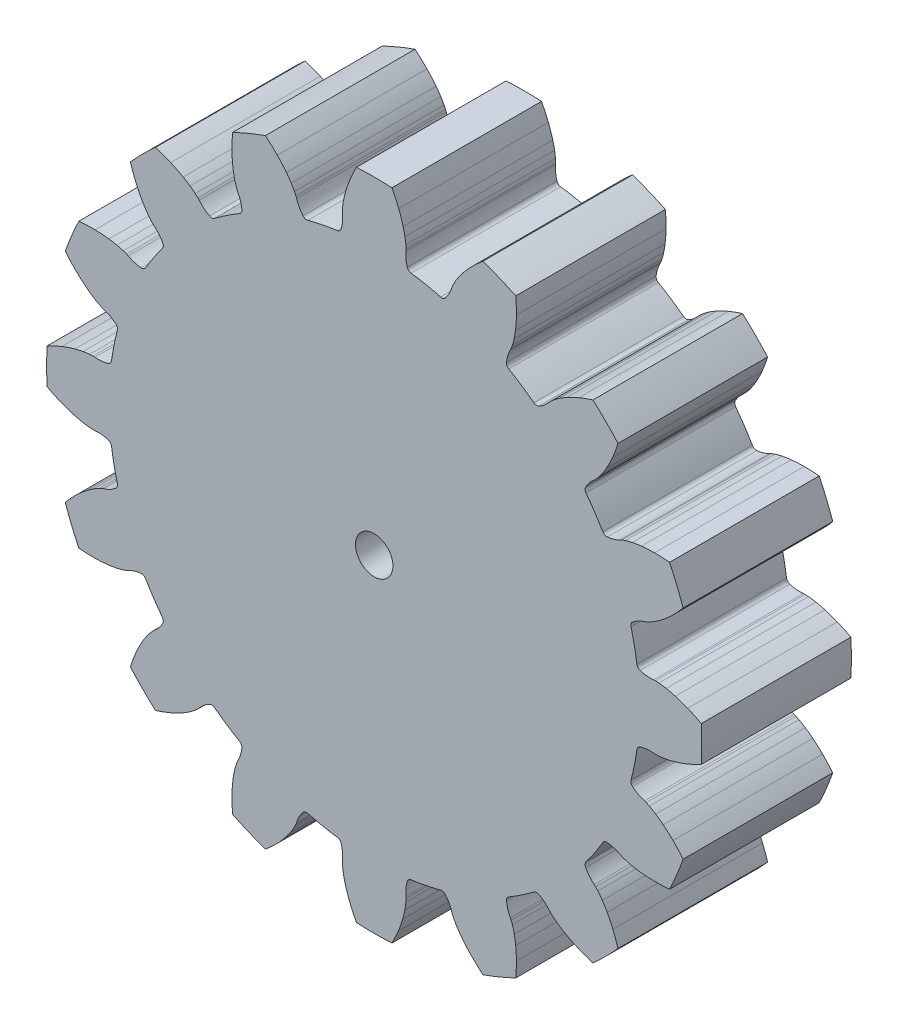
from build123d import *

# Parameters (mm, degrees)
BOSS_EXTRUDE1_DEPTH = 12.7
SKETCH2_R           = 1.5875
CUT_EXTRUDE1_DEPTH  = 42.321307839


with BuildPart() as part:
    # Model → Boss-Extrude1 (new body)
    with BuildSketch(Plane.XY):
        with BuildLine():
            ThreePointArc((22.086724936, -4.393322745), (22.202755532, -3.763289774), (22.300817937, -3.130211256))
            ThreePointArc((22.300817937, -3.130211256), (22.391700215, -2.928061147), (22.576827182, -2.806191293))
            ThreePointArc((22.576827182, -2.806191293), (23.141348869, -2.692426056), (23.717218917, -2.693402016))
            ThreePointArc((23.717218917, -2.693402016), (23.795990351, -2.699103522), (23.874961367, -2.700115778))
            ThreePointArc((23.874961367, -2.700115778), (24.020610065, -2.695308298), (24.166028598, -2.685815903))
            ThreePointArc((24.166028598, -2.685815903), (24.443766141, -2.656087394), (24.719639861, -2.612319628))
            ThreePointArc((24.719639861, -2.612319628), (25.058590913, -2.542497556), (25.39440211, -2.458868748))
            ThreePointArc((25.39440211, -2.458868748), (25.960652326, -2.287370407), (26.515782007, -2.08271942))
            ThreePointArc((26.515782007, -2.08271942), (27.147013649, -1.809737889), (27.763557433, -1.505031367))
            ThreePointArc((27.763557433, -1.505031367), (27.804320541, 0), (27.763557433, 1.505031367))
            ThreePointArc((27.763557433, 1.505031367), (27.192336158, 1.788710415), (26.608421948, 2.045248409))
            ThreePointArc((26.608421948, 2.045248409), (26.087795145, 2.243333519), (25.557268985, 2.413133319))
            ThreePointArc((25.557268985, 2.413133319), (25.175253154, 2.514973473), (24.789072057, 2.599659205))
            ThreePointArc((24.789072057, 2.599659205), (24.478759923, 2.6514833), (24.166028997, 2.68581587))
            ThreePointArc((24.166028997, 2.68581587), (24.020610388, 2.695308282), (23.874961613, 2.700115775))
            ThreePointArc((23.874961613, 2.700115775), (23.79599049, 2.699103524), (23.71721895, 2.693402019))
            ThreePointArc((23.71721895, 2.693402019), (23.141348906, 2.692426051), (22.576827219, 2.806191272))
            ThreePointArc((22.576827219, 2.806191272), (22.391700244, 2.928061115), (22.300817942, 3.130211215))
            ThreePointArc((22.300817942, 3.130211215), (22.08672494, 4.393322725), (21.801149238, 5.64221544))
            ThreePointArc((21.801149238, 5.64221544), (21.807754017, 5.863756931), (21.932151458, 6.047195017))
            ThreePointArc((21.932151458, 6.047195017), (22.410165419, 6.368333489), (22.942573453, 6.587807746))
            ThreePointArc((22.942573453, 6.587807746), (23.017530641, 6.612684764), (23.09087772, 6.641970461))
            ThreePointArc((23.09087772, 6.641970461), (23.223599828, 6.702149337), (23.354316452, 6.76656843))
            ThreePointArc((23.354316452, 6.76656843), (23.599535876, 6.900319547), (23.83766076, 7.046327993))
            ThreePointArc((23.83766076, 7.046327993), (24.12409095, 7.240546128), (24.402336682, 7.446318452))
            ThreePointArc((24.402336682, 7.446318452), (24.859854093, 7.821456836), (25.294410501, 8.222968626))
            ThreePointArc((25.294410501, 8.222968626), (25.773126986, 8.716732567), (26.226133031, 9.234185777))
            ThreePointArc((26.226133031, 9.234185777), (25.687842663, 10.640252819), (25.074231893, 12.015121129))
            ThreePointArc((25.074231893, 12.015121129), (24.437932976, 12.058609477), (23.800293749, 12.072165385))
            ThreePointArc((23.800293749, 12.072165385), (23.243493412, 12.055936912), (22.688371581, 12.0097879))
            ThreePointArc((22.688371581, 12.0097879), (22.296462434, 11.957684804), (21.907269796, 11.888139111))
            ThreePointArc((21.907269796, 11.888139111), (21.600746544, 11.817267019), (21.298682337, 11.729309234))
            ThreePointArc((21.298682337, 11.729309234), (21.160700471, 11.682429787), (21.024298801, 11.631133957))
            ThreePointArc((21.024298801, 11.631133957), (20.951726369, 11.599977819), (20.881132826, 11.564565752))
            ThreePointArc((20.881132826, 11.564565752), (20.349471766, 11.34328815), (19.784385669, 11.232360413))
            ThreePointArc((19.784385669, 11.232360413), (19.566713076, 11.27410844), (19.405389283, 11.426091629))
            ThreePointArc((19.405389283, 11.426091629), (18.724221293, 12.511124655), (17.982453195, 13.555665983))
            ThreePointArc((17.982453195, 13.555665983), (17.903774957, 13.762871171), (17.948504491, 13.979950705))
            ThreePointArc((17.948504491, 13.979950705), (18.267237433, 14.459571989), (18.675129157, 14.866083497))
            ThreePointArc((18.675129157, 14.866083497), (18.734860545, 14.917751739), (18.791417259, 14.972876907))
            ThreePointArc((18.791417259, 14.972876907), (18.89100704, 15.079265491), (18.987121334, 15.188804058))
            ThreePointArc((18.987121334, 15.188804058), (19.162490204, 15.406215388), (19.326613898, 15.632236051))
            ThreePointArc((19.326613898, 15.632236051), (19.516916824, 15.921282299), (19.695236702, 16.21787117))
            ThreePointArc((19.695236702, 16.21787117), (19.97436843, 16.739538178), (20.222194291, 17.27678424))
            ThreePointArc((20.222194291, 17.27678424), (20.475515373, 17.916159507), (20.696017616, 18.567581845))
            ThreePointArc((20.696017616, 18.567581845), (19.660623601, 19.660623601), (18.567581845, 20.696017616))
            ThreePointArc((18.567581845, 20.696017616), (17.96307603, 20.492694557), (17.368786577, 20.261204615))
            ThreePointArc((17.368786577, 20.261204615), (16.860580509, 20.033133198), (16.365375275, 19.778061142))
            ThreePointArc((16.365375275, 19.778061142), (16.023237426, 19.57994702), (15.690284298, 19.366757603))
            ThreePointArc((15.690284298, 19.366757603), (15.434215315, 19.183978958), (15.188804364, 18.987121593))
            ThreePointArc((15.188804364, 18.987121593), (15.07926573, 18.891007257), (14.972877082, 18.791417431))
            ThreePointArc((14.972877082, 18.791417431), (14.917751836, 18.734860646), (14.866083518, 18.675129183))
            ThreePointArc((14.866083518, 18.675129183), (14.459572019, 18.267237456), (13.979950747, 17.948504502))
            ThreePointArc((13.979950747, 17.948504502), (13.762871214, 17.903774955), (13.555666016, 17.98245317))
            ThreePointArc((13.555666016, 17.98245317), (12.511124689, 18.72422127), (11.426091665, 19.405389262))
            ThreePointArc((11.426091665, 19.405389262), (11.274108459, 19.566713037), (11.232360418, 19.784385626))
            ThreePointArc((11.232360418, 19.784385626), (11.34328814, 20.34947173), (11.564565736, 20.881132797))
            ThreePointArc((11.564565736, 20.881132797), (11.599977764, 20.951726241), (11.631133866, 21.024298573))
            ThreePointArc((11.631133866, 21.024298573), (11.682429677, 21.160700167), (11.729309111, 21.298681955))
            ThreePointArc((11.729309111, 21.298681955), (11.808129107, 21.566654594), (11.873265265, 21.838277877))
            ThreePointArc((11.873265265, 21.838277877), (11.938469034, 22.178147567), (11.989715472, 22.520400017))
            ThreePointArc((11.989715472, 22.520400017), (12.047966241, 23.109176576), (12.071332314, 23.700366068))
            ThreePointArc((12.071332314, 23.700366068), (12.060692156, 24.388013572), (12.015121129, 25.074231893))
            ThreePointArc((12.015121129, 25.074231893), (10.640252819, 25.687842663), (9.234185777, 26.226133031))
            ThreePointArc((9.234185777, 26.226133031), (8.753503593, 25.806952658), (8.293039097, 25.365659111))
            ThreePointArc((8.293039097, 25.365659111), (7.910797066, 24.960466554), (7.550898935, 24.535303864))
            ThreePointArc((7.550898935, 24.535303864), (7.310619771, 24.221339795), (7.084595249, 23.896962811))
            ThreePointArc((7.084595249, 23.896962811), (6.917964716, 23.630104004), (6.766568613, 23.354316809))
            ThreePointArc((6.766568613, 23.354316809), (6.702149475, 23.223600121), (6.641970558, 23.090877946))
            ThreePointArc((6.641970558, 23.090877946), (6.612684816, 23.017530771), (6.587807755, 22.942573485))
            ThreePointArc((6.587807755, 22.942573485), (6.368333508, 22.410165451), (6.047195052, 21.932151485))
            ThreePointArc((6.047195052, 21.932151485), (5.863756971, 21.807754032), (5.64221548, 21.801149227))
            ThreePointArc((5.64221548, 21.801149227), (4.393322765, 22.086724932), (3.130211256, 22.300817937))
            ThreePointArc((3.130211256, 22.300817937), (2.928061147, 22.391700215), (2.806191293, 22.576827182))
            ThreePointArc((2.806191293, 22.576827182), (2.692426056, 23.141348869), (2.693402016, 23.717218917))
            ThreePointArc((2.693402016, 23.717218917), (2.699103522, 23.795990351), (2.700115778, 23.874961367))
            ThreePointArc((2.700115778, 23.874961367), (2.695308298, 24.020610065), (2.685815903, 24.166028598))
            ThreePointArc((2.685815903, 24.166028598), (2.656087394, 24.443766141), (2.612319628, 24.719639861))
            ThreePointArc((2.612319628, 24.719639861), (2.542497556, 25.058590913), (2.458868748, 25.39440211))
            ThreePointArc((2.458868748, 25.39440211), (2.287370407, 25.960652326), (2.08271942, 26.515782007))
            ThreePointArc((2.08271942, 26.515782007), (1.809737889, 27.147013649), (1.505031367, 27.763557433))
            ThreePointArc((1.505031367, 27.763557433), (0, 27.804320541), (-1.505031367, 27.763557433))
            ThreePointArc((-1.505031367, 27.763557433), (-1.788710415, 27.192336158), (-2.045248409, 26.608421948))
            ThreePointArc((-2.045248409, 26.608421948), (-2.243333519, 26.087795145), (-2.413133319, 25.557268985))
            ThreePointArc((-2.413133319, 25.557268985), (-2.514973473, 25.175253154), (-2.599659205, 24.789072057))
            ThreePointArc((-2.599659205, 24.789072057), (-2.6514833, 24.478759923), (-2.68581587, 24.166028997))
            ThreePointArc((-2.68581587, 24.166028997), (-2.695308282, 24.020610388), (-2.700115775, 23.874961613))
            ThreePointArc((-2.700115775, 23.874961613), (-2.699103524, 23.79599049), (-2.693402019, 23.71721895))
            ThreePointArc((-2.693402019, 23.71721895), (-2.692426051, 23.141348906), (-2.806191272, 22.576827219))
            ThreePointArc((-2.806191272, 22.576827219), (-2.928061115, 22.391700244), (-3.130211215, 22.300817942))
            ThreePointArc((-3.130211215, 22.300817942), (-4.393322725, 22.08672494), (-5.64221544, 21.801149238))
            ThreePointArc((-5.64221544, 21.801149238), (-5.863756931, 21.807754017), (-6.047195017, 21.932151458))
            ThreePointArc((-6.047195017, 21.932151458), (-6.368333489, 22.410165419), (-6.587807746, 22.942573453))
            ThreePointArc((-6.587807746, 22.942573453), (-6.612684764, 23.017530641), (-6.641970461, 23.09087772))
            ThreePointArc((-6.641970461, 23.09087772), (-6.702149337, 23.223599828), (-6.76656843, 23.354316452))
            ThreePointArc((-6.76656843, 23.354316452), (-6.900319547, 23.599535876), (-7.046327993, 23.83766076))
            ThreePointArc((-7.046327993, 23.83766076), (-7.240546128, 24.12409095), (-7.446318452, 24.402336682))
            ThreePointArc((-7.446318452, 24.402336682), (-7.821456836, 24.859854093), (-8.222968626, 25.294410501))
            ThreePointArc((-8.222968626, 25.294410501), (-8.716732567, 25.773126986), (-9.234185777, 26.226133031))
            ThreePointArc((-9.234185777, 26.226133031), (-10.640252819, 25.687842663), (-12.015121129, 25.074231893))
            ThreePointArc((-12.015121129, 25.074231893), (-12.058609477, 24.437932976), (-12.072165385, 23.800293749))
            ThreePointArc((-12.072165385, 23.800293749), (-12.055936912, 23.243493412), (-12.0097879, 22.688371581))
            ThreePointArc((-12.0097879, 22.688371581), (-11.957684804, 22.296462434), (-11.888139111, 21.907269796))
            ThreePointArc((-11.888139111, 21.907269796), (-11.817267019, 21.600746544), (-11.729309234, 21.298682337))
            ThreePointArc((-11.729309234, 21.298682337), (-11.682429787, 21.160700471), (-11.631133957, 21.024298801))
            ThreePointArc((-11.631133957, 21.024298801), (-11.599977819, 20.951726369), (-11.564565752, 20.881132826))
            ThreePointArc((-11.564565752, 20.881132826), (-11.34328815, 20.349471766), (-11.232360413, 19.784385669))
            ThreePointArc((-11.232360413, 19.784385669), (-11.27410844, 19.566713076), (-11.426091629, 19.405389283))
            ThreePointArc((-11.426091629, 19.405389283), (-12.511124655, 18.724221293), (-13.555665983, 17.982453195))
            ThreePointArc((-13.555665983, 17.982453195), (-13.762871171, 17.903774957), (-13.979950705, 17.948504491))
            ThreePointArc((-13.979950705, 17.948504491), (-14.459571989, 18.267237433), (-14.866083497, 18.675129157))
            ThreePointArc((-14.866083497, 18.675129157), (-14.917751739, 18.734860545), (-14.972876907, 18.791417259))
            ThreePointArc((-14.972876907, 18.791417259), (-15.079265491, 18.89100704), (-15.188804058, 18.987121334))
            ThreePointArc((-15.188804058, 18.987121334), (-15.406215388, 19.162490204), (-15.632236051, 19.326613898))
            ThreePointArc((-15.632236051, 19.326613898), (-15.921282299, 19.516916824), (-16.21787117, 19.695236702))
            ThreePointArc((-16.21787117, 19.695236702), (-16.739538178, 19.97436843), (-17.27678424, 20.222194291))
            ThreePointArc((-17.27678424, 20.222194291), (-17.916159507, 20.475515373), (-18.567581845, 20.696017616))
            ThreePointArc((-18.567581845, 20.696017616), (-19.660623601, 19.660623601), (-20.696017616, 18.567581845))
            ThreePointArc((-20.696017616, 18.567581845), (-20.492694557, 17.96307603), (-20.261204615, 17.368786577))
            ThreePointArc((-20.261204615, 17.368786577), (-20.033133198, 16.860580509), (-19.778061142, 16.365375275))
            ThreePointArc((-19.778061142, 16.365375275), (-19.57994702, 16.023237426), (-19.366757603, 15.690284298))
            ThreePointArc((-19.366757603, 15.690284298), (-19.183978958, 15.434215315), (-18.987121593, 15.188804364))
            ThreePointArc((-18.987121593, 15.188804364), (-18.891007257, 15.07926573), (-18.791417431, 14.972877082))
            ThreePointArc((-18.791417431, 14.972877082), (-18.734860646, 14.917751836), (-18.675129183, 14.866083518))
            ThreePointArc((-18.675129183, 14.866083518), (-18.267237456, 14.459572019), (-17.948504502, 13.979950747))
            ThreePointArc((-17.948504502, 13.979950747), (-17.903774955, 13.762871214), (-17.98245317, 13.555666016))
            ThreePointArc((-17.98245317, 13.555666016), (-18.72422127, 12.511124689), (-19.405389262, 11.426091665))
            ThreePointArc((-19.405389262, 11.426091665), (-19.566713037, 11.274108459), (-19.784385626, 11.232360418))
            ThreePointArc((-19.784385626, 11.232360418), (-20.34947173, 11.34328814), (-20.881132797, 11.564565736))
            ThreePointArc((-20.881132797, 11.564565736), (-20.951726241, 11.599977764), (-21.024298573, 11.631133866))
            ThreePointArc((-21.024298573, 11.631133866), (-21.160700167, 11.682429677), (-21.298681955, 11.729309111))
            ThreePointArc((-21.298681955, 11.729309111), (-21.566654594, 11.808129107), (-21.838277877, 11.873265265))
            ThreePointArc((-21.838277877, 11.873265265), (-22.178147567, 11.938469034), (-22.520400017, 11.989715472))
            ThreePointArc((-22.520400017, 11.989715472), (-23.109176576, 12.047966241), (-23.700366068, 12.071332314))
            ThreePointArc((-23.700366068, 12.071332314), (-24.388013572, 12.060692156), (-25.074231893, 12.015121129))
            ThreePointArc((-25.074231893, 12.015121129), (-25.687842663, 10.640252819), (-26.226133031, 9.234185777))
            ThreePointArc((-26.226133031, 9.234185777), (-25.806952658, 8.753503593), (-25.365659111, 8.293039097))
            ThreePointArc((-25.365659111, 8.293039097), (-24.960466554, 7.910797066), (-24.535303864, 7.550898935))
            ThreePointArc((-24.535303864, 7.550898935), (-24.221339795, 7.310619771), (-23.896962811, 7.084595249))
            ThreePointArc((-23.896962811, 7.084595249), (-23.630104004, 6.917964716), (-23.354316809, 6.766568613))
            ThreePointArc((-23.354316809, 6.766568613), (-23.223600121, 6.702149475), (-23.090877946, 6.641970558))
            ThreePointArc((-23.090877946, 6.641970558), (-23.017530771, 6.612684816), (-22.942573485, 6.587807755))
            ThreePointArc((-22.942573485, 6.587807755), (-22.410165451, 6.368333508), (-21.932151485, 6.047195052))
            ThreePointArc((-21.932151485, 6.047195052), (-21.807754032, 5.863756971), (-21.801149227, 5.64221548))
            ThreePointArc((-21.801149227, 5.64221548), (-22.086724932, 4.393322765), (-22.300817937, 3.130211256))
            ThreePointArc((-22.300817937, 3.130211256), (-22.391700215, 2.928061147), (-22.576827182, 2.806191293))
            ThreePointArc((-22.576827182, 2.806191293), (-23.141348869, 2.692426056), (-23.717218917, 2.693402016))
            ThreePointArc((-23.717218917, 2.693402016), (-23.795990351, 2.699103522), (-23.874961367, 2.700115778))
            ThreePointArc((-23.874961367, 2.700115778), (-24.020610065, 2.695308298), (-24.166028598, 2.685815903))
            ThreePointArc((-24.166028598, 2.685815903), (-24.443766141, 2.656087394), (-24.719639861, 2.612319628))
            ThreePointArc((-24.719639861, 2.612319628), (-25.058590913, 2.542497556), (-25.39440211, 2.458868748))
            ThreePointArc((-25.39440211, 2.458868748), (-25.960652326, 2.287370407), (-26.515782007, 2.08271942))
            ThreePointArc((-26.515782007, 2.08271942), (-27.147013649, 1.809737889), (-27.763557433, 1.505031367))
            ThreePointArc((-27.763557433, 1.505031367), (-27.804320541, 0), (-27.763557433, -1.505031367))
            ThreePointArc((-27.763557433, -1.505031367), (-27.192336158, -1.788710415), (-26.608421948, -2.045248409))
            ThreePointArc((-26.608421948, -2.045248409), (-26.087795145, -2.243333519), (-25.557268985, -2.413133319))
            ThreePointArc((-25.557268985, -2.413133319), (-25.175253154, -2.514973473), (-24.789072057, -2.599659205))
            ThreePointArc((-24.789072057, -2.599659205), (-24.478759923, -2.6514833), (-24.166028997, -2.68581587))
            ThreePointArc((-24.166028997, -2.68581587), (-24.020610388, -2.695308282), (-23.874961613, -2.700115775))
            ThreePointArc((-23.874961613, -2.700115775), (-23.79599049, -2.699103524), (-23.71721895, -2.693402019))
            ThreePointArc((-23.71721895, -2.693402019), (-23.141348906, -2.692426051), (-22.576827219, -2.806191272))
            ThreePointArc((-22.576827219, -2.806191272), (-22.391700244, -2.928061115), (-22.300817942, -3.130211215))
            ThreePointArc((-22.300817942, -3.130211215), (-22.08672494, -4.393322725), (-21.801149238, -5.64221544))
            ThreePointArc((-21.801149238, -5.64221544), (-21.807754017, -5.863756931), (-21.932151458, -6.047195017))
            ThreePointArc((-21.932151458, -6.047195017), (-22.410165419, -6.368333489), (-22.942573453, -6.587807746))
            ThreePointArc((-22.942573453, -6.587807746), (-23.017530641, -6.612684764), (-23.09087772, -6.641970461))
            ThreePointArc((-23.09087772, -6.641970461), (-23.223599828, -6.702149337), (-23.354316452, -6.76656843))
            ThreePointArc((-23.354316452, -6.76656843), (-23.599535876, -6.900319547), (-23.83766076, -7.046327993))
            ThreePointArc((-23.83766076, -7.046327993), (-24.12409095, -7.240546128), (-24.402336682, -7.446318452))
            ThreePointArc((-24.402336682, -7.446318452), (-24.859854093, -7.821456836), (-25.294410501, -8.222968626))
            ThreePointArc((-25.294410501, -8.222968626), (-25.773126986, -8.716732567), (-26.226133031, -9.234185777))
            ThreePointArc((-26.226133031, -9.234185777), (-25.687842663, -10.640252819), (-25.074231893, -12.015121129))
            ThreePointArc((-25.074231893, -12.015121129), (-24.437932976, -12.058609477), (-23.800293749, -12.072165385))
            ThreePointArc((-23.800293749, -12.072165385), (-23.243493412, -12.055936912), (-22.688371581, -12.0097879))
            ThreePointArc((-22.688371581, -12.0097879), (-22.296462434, -11.957684804), (-21.907269796, -11.888139111))
            ThreePointArc((-21.907269796, -11.888139111), (-21.600746544, -11.817267019), (-21.298682337, -11.729309234))
            ThreePointArc((-21.298682337, -11.729309234), (-21.160700471, -11.682429787), (-21.024298801, -11.631133957))
            ThreePointArc((-21.024298801, -11.631133957), (-20.951726369, -11.599977819), (-20.881132826, -11.564565752))
            ThreePointArc((-20.881132826, -11.564565752), (-20.349471766, -11.34328815), (-19.784385669, -11.232360413))
            ThreePointArc((-19.784385669, -11.232360413), (-19.566713076, -11.27410844), (-19.405389283, -11.426091629))
            ThreePointArc((-19.405389283, -11.426091629), (-18.724221293, -12.511124655), (-17.982453195, -13.555665983))
            ThreePointArc((-17.982453195, -13.555665983), (-17.903774957, -13.762871171), (-17.948504491, -13.979950705))
            ThreePointArc((-17.948504491, -13.979950705), (-18.267237433, -14.459571989), (-18.675129157, -14.866083497))
            ThreePointArc((-18.675129157, -14.866083497), (-18.734860545, -14.917751739), (-18.791417259, -14.972876907))
            ThreePointArc((-18.791417259, -14.972876907), (-18.89100704, -15.079265491), (-18.987121334, -15.188804058))
            ThreePointArc((-18.987121334, -15.188804058), (-19.162490204, -15.406215388), (-19.326613898, -15.632236051))
            ThreePointArc((-19.326613898, -15.632236051), (-19.516916824, -15.921282299), (-19.695236702, -16.21787117))
            ThreePointArc((-19.695236702, -16.21787117), (-19.97436843, -16.739538178), (-20.222194291, -17.27678424))
            ThreePointArc((-20.222194291, -17.27678424), (-20.475515373, -17.916159507), (-20.696017616, -18.567581845))
            ThreePointArc((-20.696017616, -18.567581845), (-19.660623601, -19.660623601), (-18.567581845, -20.696017616))
            ThreePointArc((-18.567581845, -20.696017616), (-17.96307603, -20.492694557), (-17.368786577, -20.261204615))
            ThreePointArc((-17.368786577, -20.261204615), (-16.860580509, -20.033133198), (-16.365375275, -19.778061142))
            ThreePointArc((-16.365375275, -19.778061142), (-16.023237426, -19.57994702), (-15.690284298, -19.366757603))
            ThreePointArc((-15.690284298, -19.366757603), (-15.434215315, -19.183978958), (-15.188804364, -18.987121593))
            ThreePointArc((-15.188804364, -18.987121593), (-15.07926573, -18.891007257), (-14.972877082, -18.791417431))
            ThreePointArc((-14.972877082, -18.791417431), (-14.917751836, -18.734860646), (-14.866083518, -18.675129183))
            ThreePointArc((-14.866083518, -18.675129183), (-14.459572019, -18.267237456), (-13.979950747, -17.948504502))
            ThreePointArc((-13.979950747, -17.948504502), (-13.762871214, -17.903774955), (-13.555666016, -17.98245317))
            ThreePointArc((-13.555666016, -17.98245317), (-12.511124689, -18.72422127), (-11.426091665, -19.405389262))
            ThreePointArc((-11.426091665, -19.405389262), (-11.274108459, -19.566713037), (-11.232360418, -19.784385626))
            ThreePointArc((-11.232360418, -19.784385626), (-11.34328814, -20.34947173), (-11.564565736, -20.881132797))
            ThreePointArc((-11.564565736, -20.881132797), (-11.599977764, -20.951726241), (-11.631133866, -21.024298573))
            ThreePointArc((-11.631133866, -21.024298573), (-11.682429677, -21.160700167), (-11.729309111, -21.298681955))
            ThreePointArc((-11.729309111, -21.298681955), (-11.808129107, -21.566654594), (-11.873265265, -21.838277877))
            ThreePointArc((-11.873265265, -21.838277877), (-11.938469034, -22.178147567), (-11.989715472, -22.520400017))
            ThreePointArc((-11.989715472, -22.520400017), (-12.047966241, -23.109176576), (-12.071332314, -23.700366068))
            ThreePointArc((-12.071332314, -23.700366068), (-12.060692156, -24.388013572), (-12.015121129, -25.074231893))
            ThreePointArc((-12.015121129, -25.074231893), (-10.640252819, -25.687842663), (-9.234185777, -26.226133031))
            ThreePointArc((-9.234185777, -26.226133031), (-8.753503593, -25.806952658), (-8.293039097, -25.365659111))
            ThreePointArc((-8.293039097, -25.365659111), (-7.910797066, -24.960466554), (-7.550898935, -24.535303864))
            ThreePointArc((-7.550898935, -24.535303864), (-7.310619771, -24.221339795), (-7.084595249, -23.896962811))
            ThreePointArc((-7.084595249, -23.896962811), (-6.917964716, -23.630104004), (-6.766568613, -23.354316809))
            ThreePointArc((-6.766568613, -23.354316809), (-6.702149475, -23.223600121), (-6.641970558, -23.090877946))
            ThreePointArc((-6.641970558, -23.090877946), (-6.612684816, -23.017530771), (-6.587807755, -22.942573485))
            ThreePointArc((-6.587807755, -22.942573485), (-6.368333508, -22.410165451), (-6.047195052, -21.932151485))
            ThreePointArc((-6.047195052, -21.932151485), (-5.863756971, -21.807754032), (-5.64221548, -21.801149227))
            ThreePointArc((-5.64221548, -21.801149227), (-4.393322765, -22.086724932), (-3.130211256, -22.300817937))
            ThreePointArc((-3.130211256, -22.300817937), (-2.928061147, -22.391700215), (-2.806191293, -22.576827182))
            ThreePointArc((-2.806191293, -22.576827182), (-2.692426056, -23.141348869), (-2.693402016, -23.717218917))
            ThreePointArc((-2.693402016, -23.717218917), (-2.699103522, -23.795990351), (-2.700115778, -23.874961367))
            ThreePointArc((-2.700115778, -23.874961367), (-2.695308298, -24.020610065), (-2.685815903, -24.166028598))
            ThreePointArc((-2.685815903, -24.166028598), (-2.656087394, -24.443766141), (-2.612319628, -24.719639861))
            ThreePointArc((-2.612319628, -24.719639861), (-2.542497556, -25.058590913), (-2.458868748, -25.39440211))
            ThreePointArc((-2.458868748, -25.39440211), (-2.287370407, -25.960652326), (-2.08271942, -26.515782007))
            ThreePointArc((-2.08271942, -26.515782007), (-1.809737889, -27.147013649), (-1.505031367, -27.763557433))
            ThreePointArc((-1.505031367, -27.763557433), (0, -27.804320541), (1.505031367, -27.763557433))
            ThreePointArc((1.505031367, -27.763557433), (1.788710415, -27.192336158), (2.045248409, -26.608421948))
            ThreePointArc((2.045248409, -26.608421948), (2.243333519, -26.087795145), (2.413133319, -25.557268985))
            ThreePointArc((2.413133319, -25.557268985), (2.514973473, -25.175253154), (2.599659205, -24.789072057))
            ThreePointArc((2.599659205, -24.789072057), (2.6514833, -24.478759923), (2.68581587, -24.166028997))
            ThreePointArc((2.68581587, -24.166028997), (2.695308282, -24.020610388), (2.700115775, -23.874961613))
            ThreePointArc((2.700115775, -23.874961613), (2.699103524, -23.79599049), (2.693402019, -23.71721895))
            ThreePointArc((2.693402019, -23.71721895), (2.692426051, -23.141348906), (2.806191272, -22.576827219))
            ThreePointArc((2.806191272, -22.576827219), (2.928061115, -22.391700244), (3.130211215, -22.300817942))
            ThreePointArc((3.130211215, -22.300817942), (4.393322725, -22.08672494), (5.64221544, -21.801149238))
            ThreePointArc((5.64221544, -21.801149238), (5.863756931, -21.807754017), (6.047195017, -21.932151458))
            ThreePointArc((6.047195017, -21.932151458), (6.368333489, -22.410165419), (6.587807746, -22.942573453))
            ThreePointArc((6.587807746, -22.942573453), (6.612684764, -23.017530641), (6.641970461, -23.09087772))
            ThreePointArc((6.641970461, -23.09087772), (6.702149337, -23.223599828), (6.76656843, -23.354316452))
            ThreePointArc((6.76656843, -23.354316452), (6.900319547, -23.599535876), (7.046327993, -23.83766076))
            ThreePointArc((7.046327993, -23.83766076), (7.240546128, -24.12409095), (7.446318452, -24.402336682))
            ThreePointArc((7.446318452, -24.402336682), (7.821456836, -24.859854093), (8.222968626, -25.294410501))
            ThreePointArc((8.222968626, -25.294410501), (8.716732567, -25.773126986), (9.234185777, -26.226133031))
            ThreePointArc((9.234185777, -26.226133031), (10.640252819, -25.687842663), (12.015121129, -25.074231893))
            ThreePointArc((12.015121129, -25.074231893), (12.058609477, -24.437932976), (12.072165385, -23.800293749))
            ThreePointArc((12.072165385, -23.800293749), (12.055936912, -23.243493412), (12.0097879, -22.688371581))
            ThreePointArc((12.0097879, -22.688371581), (11.957684804, -22.296462434), (11.888139111, -21.907269796))
            ThreePointArc((11.888139111, -21.907269796), (11.817267019, -21.600746544), (11.729309234, -21.298682337))
            ThreePointArc((11.729309234, -21.298682337), (11.682429787, -21.160700471), (11.631133957, -21.024298801))
            ThreePointArc((11.631133957, -21.024298801), (11.599977819, -20.951726369), (11.564565752, -20.881132826))
            ThreePointArc((11.564565752, -20.881132826), (11.34328815, -20.349471766), (11.232360413, -19.784385669))
            ThreePointArc((11.232360413, -19.784385669), (11.27410844, -19.566713076), (11.426091629, -19.405389283))
            ThreePointArc((11.426091629, -19.405389283), (12.511124655, -18.724221293), (13.555665983, -17.982453195))
            ThreePointArc((13.555665983, -17.982453195), (13.762871171, -17.903774957), (13.979950705, -17.948504491))
            ThreePointArc((13.979950705, -17.948504491), (14.459571989, -18.267237433), (14.866083497, -18.675129157))
            ThreePointArc((14.866083497, -18.675129157), (14.917751739, -18.734860545), (14.972876907, -18.791417259))
            ThreePointArc((14.972876907, -18.791417259), (15.079265491, -18.89100704), (15.188804058, -18.987121334))
            ThreePointArc((15.188804058, -18.987121334), (15.406215388, -19.162490204), (15.632236051, -19.326613898))
            ThreePointArc((15.632236051, -19.326613898), (15.921282299, -19.516916824), (16.21787117, -19.695236702))
            ThreePointArc((16.21787117, -19.695236702), (16.739538178, -19.97436843), (17.27678424, -20.222194291))
            ThreePointArc((17.27678424, -20.222194291), (17.916159507, -20.475515373), (18.567581845, -20.696017616))
            ThreePointArc((18.567581845, -20.696017616), (19.660623601, -19.660623601), (20.696017616, -18.567581845))
            ThreePointArc((20.696017616, -18.567581845), (20.492694557, -17.96307603), (20.261204615, -17.368786577))
            ThreePointArc((20.261204615, -17.368786577), (20.033133198, -16.860580509), (19.778061142, -16.365375275))
            ThreePointArc((19.778061142, -16.365375275), (19.57994702, -16.023237426), (19.366757603, -15.690284298))
            ThreePointArc((19.366757603, -15.690284298), (19.183978958, -15.434215315), (18.987121593, -15.188804364))
            ThreePointArc((18.987121593, -15.188804364), (18.891007257, -15.07926573), (18.791417431, -14.972877082))
            ThreePointArc((18.791417431, -14.972877082), (18.734860646, -14.917751836), (18.675129183, -14.866083518))
            ThreePointArc((18.675129183, -14.866083518), (18.267237456, -14.459572019), (17.948504502, -13.979950747))
            ThreePointArc((17.948504502, -13.979950747), (17.903774955, -13.762871214), (17.98245317, -13.555666016))
            ThreePointArc((17.98245317, -13.555666016), (18.72422127, -12.511124689), (19.405389262, -11.426091665))
            ThreePointArc((19.405389262, -11.426091665), (19.566713037, -11.274108459), (19.784385626, -11.232360418))
            ThreePointArc((19.784385626, -11.232360418), (20.34947173, -11.34328814), (20.881132797, -11.564565736))
            ThreePointArc((20.881132797, -11.564565736), (20.951726241, -11.599977764), (21.024298573, -11.631133866))
            ThreePointArc((21.024298573, -11.631133866), (21.160700167, -11.682429677), (21.298681955, -11.729309111))
            ThreePointArc((21.298681955, -11.729309111), (21.566654594, -11.808129107), (21.838277877, -11.873265265))
            ThreePointArc((21.838277877, -11.873265265), (22.178147567, -11.938469034), (22.520400017, -11.989715472))
            ThreePointArc((22.520400017, -11.989715472), (23.109176576, -12.047966241), (23.700366068, -12.071332314))
            ThreePointArc((23.700366068, -12.071332314), (24.388013572, -12.060692156), (25.074231893, -12.015121129))
            ThreePointArc((25.074231893, -12.015121129), (25.687842663, -10.640252819), (26.226133031, -9.234185777))
            ThreePointArc((26.226133031, -9.234185777), (25.806952658, -8.753503593), (25.365659111, -8.293039097))
            ThreePointArc((25.365659111, -8.293039097), (24.960466554, -7.910797066), (24.535303864, -7.550898935))
            ThreePointArc((24.535303864, -7.550898935), (24.221339795, -7.310619771), (23.896962811, -7.084595249))
            ThreePointArc((23.896962811, -7.084595249), (23.630104004, -6.917964716), (23.354316809, -6.766568613))
            ThreePointArc((23.354316809, -6.766568613), (23.223600121, -6.702149475), (23.090877946, -6.641970558))
            ThreePointArc((23.090877946, -6.641970558), (23.017530771, -6.612684816), (22.942573485, -6.587807755))
            ThreePointArc((22.942573485, -6.587807755), (22.410165451, -6.368333508), (21.932151485, -6.047195052))
            ThreePointArc((21.932151485, -6.047195052), (21.807754032, -5.863756971), (21.801149227, -5.64221548))
            ThreePointArc((21.801149227, -5.64221548), (21.952820045, -5.019800319), (22.086724936, -4.393322745))
        make_face()
    extrude(amount=BOSS_EXTRUDE1_DEPTH)

    # Sketch2 → Cut-Extrude1 (cut, through all)
    with BuildSketch(Plane.XY.offset(12.7)):
        Circle(SKETCH2_R)
    extrude(amount=-CUT_EXTRUDE1_DEPTH, mode=Mode.SUBTRACT)


solid = part.part
